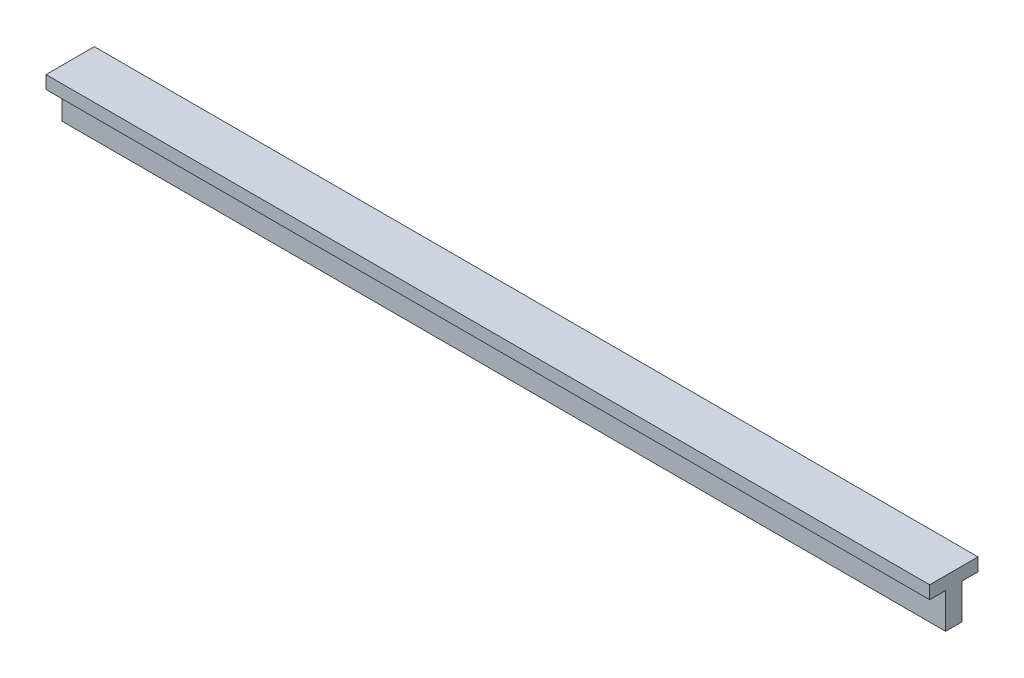
from build123d import *

# Parameters (mm, degrees)
BOSS_EXTRUDE1_DEPTH = 1500


with BuildPart() as part:
    # Sketch1 → Boss-Extrude1 (new body)
    with BuildSketch(Plane(origin=(0, 0, 0), x_dir=(0, 0, -1), z_dir=(1, 0, 0))):
        Polygon((55, -22), (82, -22), (82, 0), (0, 0), (0, -22), (27, -22), (27, -82), (55, -82), align=None)
    extrude(amount=BOSS_EXTRUDE1_DEPTH)


solid = part.part
